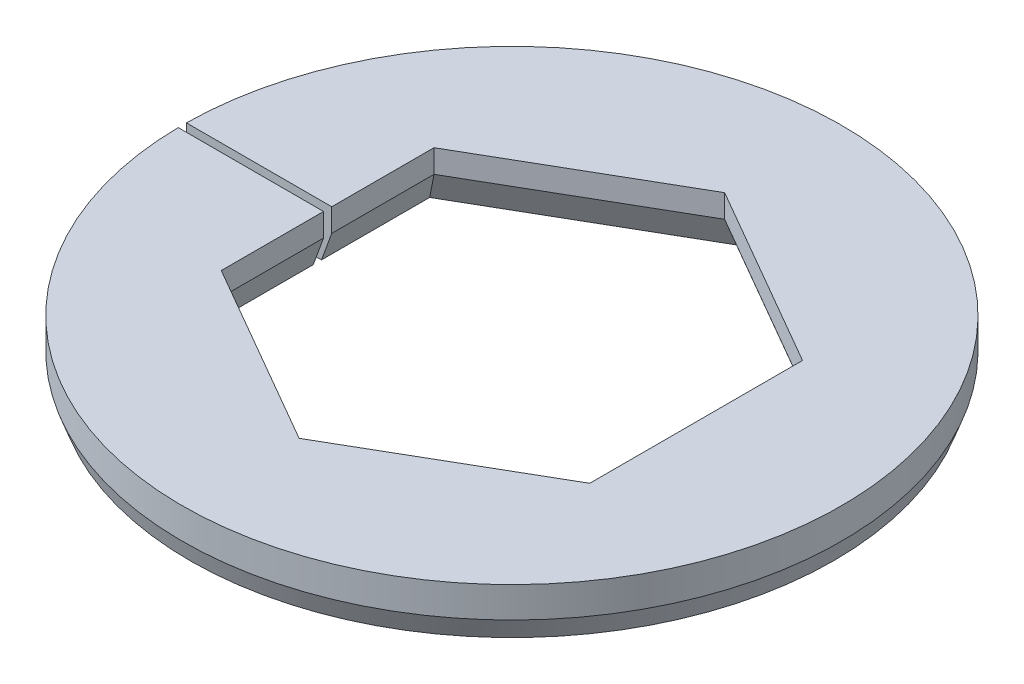
from build123d import *

# Parameters (mm, degrees)
SKETCH_1_R          = 16.1
EXTRUDE_1_DEPTH     = 2.5
CUT_EXTRUDE_1_DEPTH = 23.905676152
SKETCH_3_W          = 7.1
SKETCH_3_H          = 0.4
CUT_EXTRUDE_2_DEPTH = 23.905676152
CHAMFER_1_SIZE      = 1
CHAMFER_1_SIZE2     = 0.363970234
CHAMFER_2_SIZE      = 0.5
CHAMFER_2_SIZE2     = 1.37373871


with BuildPart() as part:
    # Эскиз1 → Бобышка-Вытянуть1 (new body)
    with BuildSketch(Plane(origin=(0, 0, 0), x_dir=(1, 0, 0), z_dir=(0, 1, 0))):
        with Locations(Location((0, 0, 0), (0, 0, 270))):
            Circle(SKETCH_1_R)
    extrude(amount=EXTRUDE_1_DEPTH)

    # Эскиз2 → Вырез-Вытянуть1 (cut, through all)
    with BuildSketch(Plane(origin=(0, 2.5, 0), x_dir=(1, 0, 0), z_dir=(0, 1, 0))):
        Polygon((0, 10.392304845), (-9, 5.196152423), (-9, -5.196152423), (0, -10.392304845), (9, -5.196152423), (9, 5.196152423), align=None)
    extrude(amount=-CUT_EXTRUDE_1_DEPTH, mode=Mode.SUBTRACT)

    # Эскиз3 → Вырез-Вытянуть2 (cut, through all)
    with BuildSketch(Plane(origin=(0, 2.5, 0), x_dir=(1, 0, 0), z_dir=(0, 1, 0))):
        with Locations((-12.55, 0)):
            Rectangle(SKETCH_3_W, SKETCH_3_H)
    extrude(amount=-CUT_EXTRUDE_2_DEPTH, mode=Mode.SUBTRACT)

    # Фаска1
    chamfer_1_edges = [part.edges().sort_by_distance(p)[0] for p in [
        (11.45491161, 0, -11.313487526),
    ]]
    chamfer_1_side = [part.faces().sort_by_distance(p)[0] for p in [
        (11.45491161, 1.25, -11.313487526),
    ]]
    chamfer(chamfer_1_edges, length=CHAMFER_1_SIZE, length2=CHAMFER_1_SIZE2, reference=chamfer_1_side[0])

    # Фаска2
    chamfer_2_edges = [part.edges().sort_by_distance(p)[0] for p in [
        (4.5, 0, -7.794228634),
        (9, 0, 0),
        (4.5, 0, 7.794228634),
        (-4.5, 0, 7.794228634),
        (-9, 0, -2.698076211),
        (-4.5, 0, -7.794228634),
        (-9, 0, 2.698076211),
    ]]
    chamfer_2_side = [part.faces().sort_by_distance(p)[0] for p in [
        (-12.367379373, 0, -0.245073147),
    ]]
    chamfer(chamfer_2_edges, length=CHAMFER_2_SIZE, length2=CHAMFER_2_SIZE2, reference=chamfer_2_side[0])


solid = part.part
